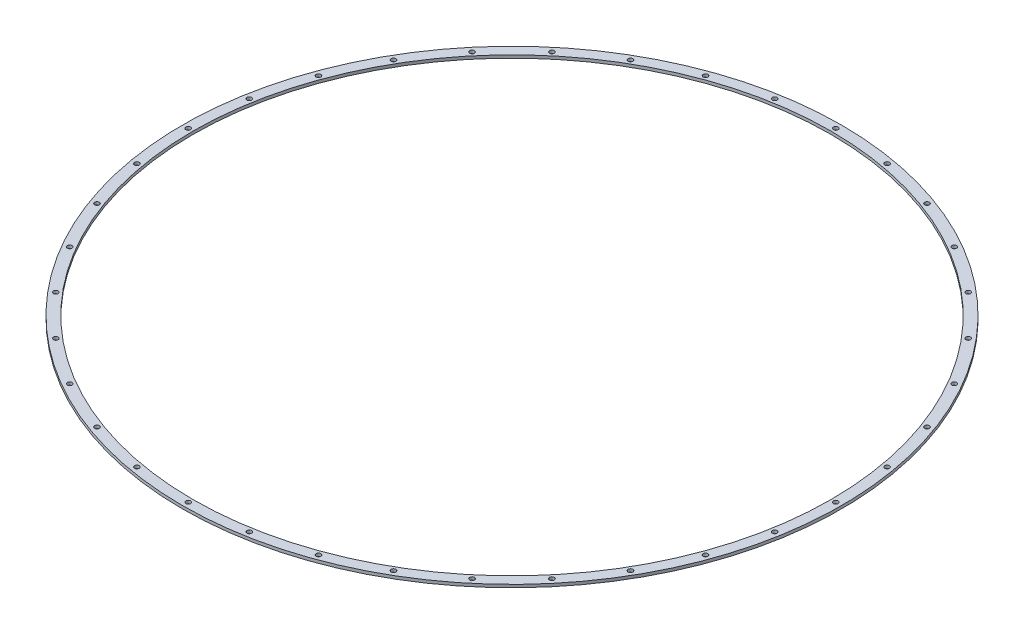
from build123d import *

# Parameters (mm, degrees)
SKETCH1_R               = 715
SKETCH1_R_2             = 692.22
BOSS_EXTRUDE1_DEPTH     = 6.35
F_3_8_CLEARANCE_HOLE1_D = 10.31748
CIRPATTERN1_COUNT       = 36


with BuildPart() as part:
    # Sketch1 → Boss-Extrude1 (new body)
    with BuildSketch(Plane(origin=(0, 0, 0), x_dir=(1, 0, 0), z_dir=(0, 1, 0))):
        with Locations(Location((0, 0, 0), (0, 0, 270))):
            Circle(SKETCH1_R)
        with Locations(Location((0, 0, 0), (0, 0, 270))):
            Circle(SKETCH1_R_2, mode=Mode.SUBTRACT)
    extrude(amount=BOSS_EXTRUDE1_DEPTH)

    # 3/8 Clearance Hole1 (through all)
    with Locations(Plane(origin=(0, 6.35, 0), x_dir=(1, 0, 0), z_dir=(0, 1, 0))):
        with Locations((0, -702.5)):
            f_3_8_clearance_hole1 = Hole(F_3_8_CLEARANCE_HOLE1_D / 2)

    # CirPattern1: 3/8 Clearance Hole1 ×36 about axis
    cirpattern1_axis = Axis((0, 0, 0), (0, 1, 0))
    for i in range(1, CIRPATTERN1_COUNT):
        add(f_3_8_clearance_hole1.rotate(cirpattern1_axis, i * 360 / CIRPATTERN1_COUNT), mode=Mode.SUBTRACT)


solid = part.part
